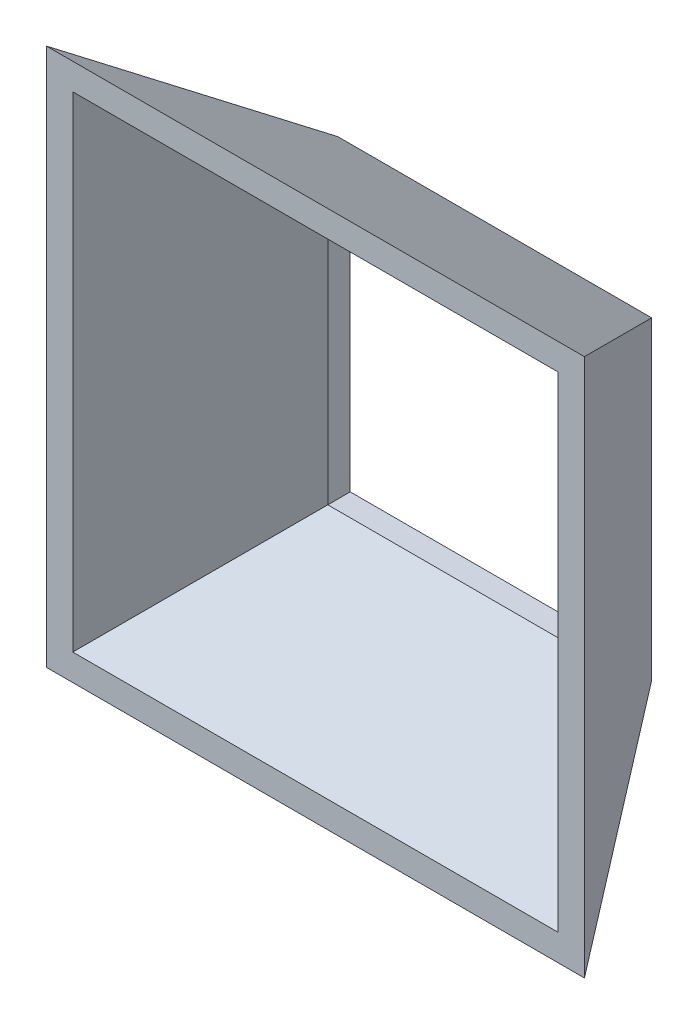
from build123d import *

# Parameters (mm, degrees)
SHELL1_T           = -6.35
SKETCH4_W          = 81.861054952
SKETCH4_H          = 81.861054952
CUT_EXTRUDE1_DEPTH = 117.570504586


with BuildPart() as part:
    # Sketch1 → Loft1 section 0
    with BuildSketch(Plane.XY):
        with BuildLine():
            Line((-44.45, 44.45), (44.45, 44.45))
            Line((44.45, 44.45), (44.45, -44.45))
            Line((44.45, -44.45), (-44.45, -44.45))
            Line((-44.45, -44.45), (-44.45, 44.45))
        make_face()
    # Sketch2 → Loft1 section 1
    with BuildSketch(Plane.XY.offset(50.8)):
        with BuildLine():
            Line((-76.2, 76.2), (76.2, 76.2))
            Line((76.2, 76.2), (76.2, -76.2))
            Line((76.2, -76.2), (-76.2, -76.2))
            Line((-76.2, -76.2), (-76.2, 76.2))
        make_face()
    loft()

    # Shell1
    shell1_openings = [part.faces().sort_by_distance(p)[0] for p in [
        (0, 0, 50.8),
    ]]
    offset(amount=SHELL1_T, openings=shell1_openings, kind=Kind.INTERSECTION)

    # Sketch4 → Cut-Extrude1 (cut, through all)
    with BuildSketch(Plane.XY.offset(6.35)):
        Rectangle(SKETCH4_W, SKETCH4_H)
    extrude(amount=-CUT_EXTRUDE1_DEPTH, mode=Mode.SUBTRACT)


solid = part.part
